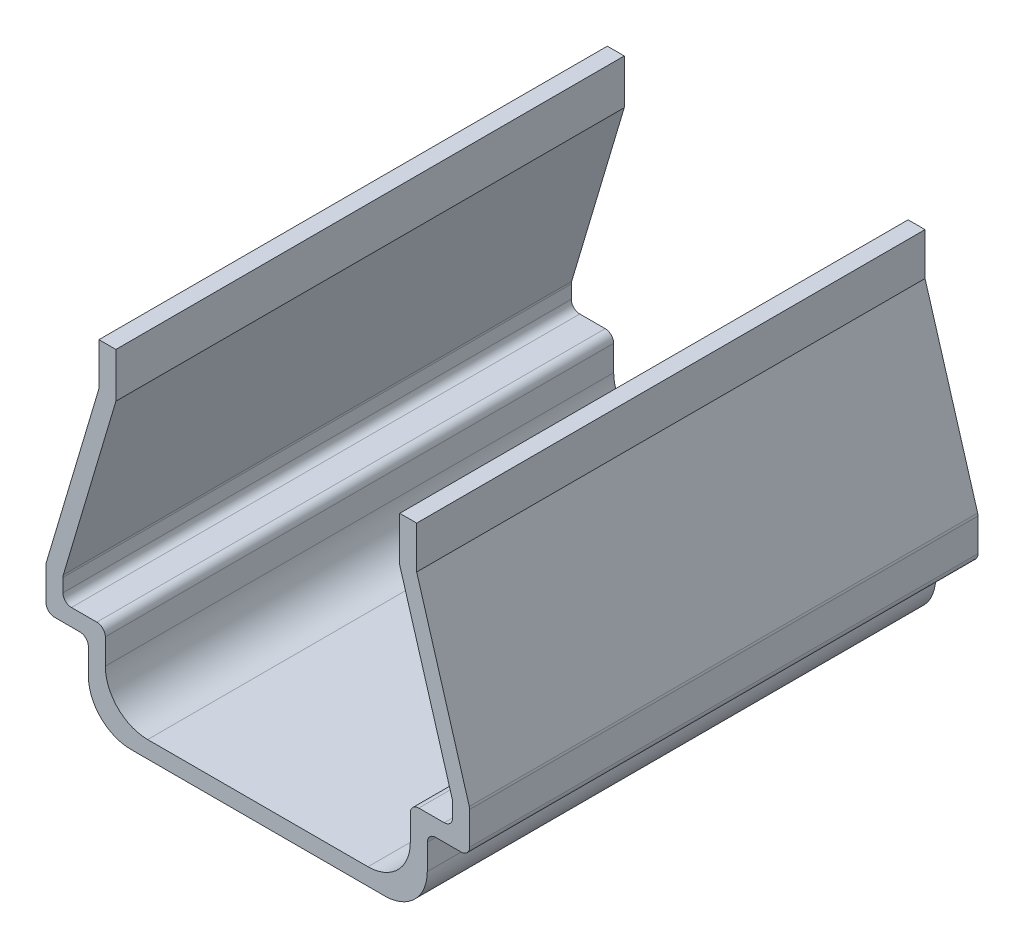
from build123d import *

# Parameters (mm, degrees)
EXTRUDE_THIN1_DEPTH = 12
FILLET1_R           = 1
FILLET2_R           = 0.2


with BuildPart() as part:
    # Sketch1 → Extrude-Thin1 (new body)
    with BuildSketch(Plane.XY):
        Polygon((3.75, 8), (3.75, 7), (5, 2.8), (5, 1.8), (4, 1.8), (4, 0), (-4, 0), (-4, 1.8), (-5, 1.8), (-5, 2.8), (-3.75, 7), (-3.75, 8), (-3.35, 8), (-3.35, 6.941738969), (-4.6, 2.741738969), (-4.6, 2.2), (-3.6, 2.2), (-3.6, 0.4), (3.6, 0.4), (3.6, 2.2), (4.6, 2.2), (4.6, 2.741738969), (3.35, 6.941738969), (3.35, 8), align=None)
    extrude(amount=EXTRUDE_THIN1_DEPTH)

    # Fillet1
    fillet1_edges = [part.edges().sort_by_distance(p)[0] for p in [
        (4, 0, 6),
        (-4, 0, 6),
        (-3.6, 0.4, 6),
        (3.6, 0.4, 6),
    ]]
    fillet(fillet1_edges, radius=FILLET1_R)

    # Fillet2
    fillet2_edges = [part.edges().sort_by_distance(p)[0] for p in [
        (5, 2.8, 6),
        (5, 1.8, 6),
        (4, 1.8, 6),
        (-4, 1.8, 6),
        (-5, 1.8, 6),
        (-5, 2.8, 6),
        (-4.6, 2.741738969, 6),
        (-4.6, 2.2, 6),
        (-3.6, 2.2, 6),
        (3.6, 2.2, 6),
        (4.6, 2.2, 6),
        (4.6, 2.741738969, 6),
    ]]
    fillet(fillet2_edges, radius=FILLET2_R)


solid = part.part
